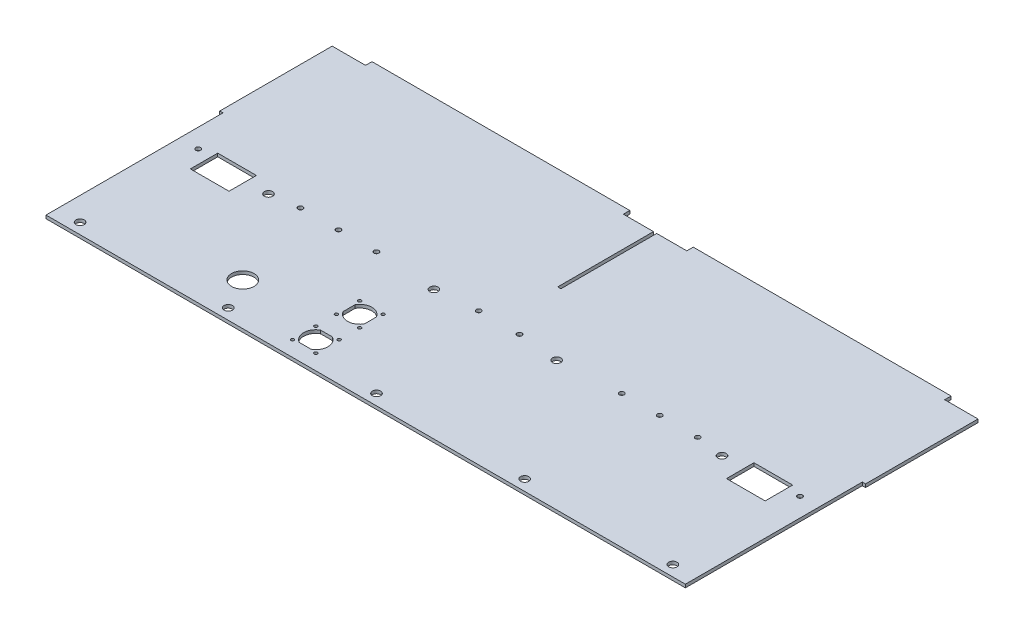
from build123d import *

# Parameters (mm, degrees)
SKETCH1_W            = 629.90984
SKETCH1_H            = 147.69846
BOSS_EXTRUDE1_DEPTH  = 3.175
SKETCH3_W            = 254
SKETCH3_H            = 3.175
BOSS_EXTRUDE2_DEPTH  = 6.35
SKETCH4_W            = 3.175
SKETCH4_H            = 188.732840052
CUT_EXTRUDE1_DEPTH   = 3.175
SKETCH6_W            = 3.175
SKETCH6_H            = 110.773845
BOSS_EXTRUDE4_DEPTH  = 3.175
SKETCH8_W            = 629.90984
SKETCH8_H            = 18.04416
BOSS_EXTRUDE5_DEPTH  = 3.175
SKETCH10_W           = 38.1
SKETCH10_H           = 36.08832
CUT_EXTRUDE3_DEPTH   = 652.56536379
BOSS_EXTRUDE6_DEPTH  = 3.175
SKETCH13_R           = 1.55
SKETCH13_R_2         = 11.049
CUT_EXTRUDE4_DEPTH   = 652.56536379
SKETCH20_W           = 20.59499956
SKETCH20_H           = 2.942142794
CUT_EXTRUDE7_DEPTH   = 1.27
SKETCH21_R           = 4.064
CUT_EXTRUDE8_DEPTH   = 652.56536379
SKETCH23_R           = 4.064
CUT_EXTRUDE10_DEPTH  = 652.56536379
M4_CLEARANCE_HOLE1_D = 4.8


with BuildPart() as part:
    # Sketch1 → Boss-Extrude1 (new body)
    with BuildSketch(Plane(origin=(0, 0, 0), x_dir=(1, 0, 0), z_dir=(0, 1, 0))):
        with Locations((314.95492, 73.84923)):
            Rectangle(SKETCH1_W, SKETCH1_H)
    extrude(amount=BOSS_EXTRUDE1_DEPTH)

    # Sketch3 → Boss-Extrude2 (add)
    with BuildSketch(Plane(origin=(0, 0, -147.69846), x_dir=(-1, 0, 0), z_dir=(0, 0, -1))):
        with Locations((-473.22613, 1.5875)):
            Rectangle(SKETCH3_W, SKETCH3_H)
        with Locations((-156.68371, 1.5875)):
            Rectangle(SKETCH3_W, SKETCH3_H)
    extrude(amount=BOSS_EXTRUDE2_DEPTH)

    # Sketch4 → Cut-Extrude1 (cut)
    with BuildSketch(Plane(origin=(0, 3.175, 0), x_dir=(1, 0, 0), z_dir=(0, 1, 0))):
        with Locations((314.95492, 147.69846)):
            Rectangle(SKETCH4_W, SKETCH4_H)
    extrude(amount=-CUT_EXTRUDE1_DEPTH, mode=Mode.SUBTRACT)

    # Sketch6 → Boss-Extrude4 (add)
    with BuildSketch(Plane(origin=(0, 3.175, 0), x_dir=(1, 0, 0), z_dir=(0, 1, 0))):
        with Locations((631.49734, 92.3115375)):
            Rectangle(SKETCH6_W, SKETCH6_H)
        with Locations((-1.5875, 92.3115375)):
            Rectangle(SKETCH6_W, SKETCH6_H)
    extrude(amount=-BOSS_EXTRUDE4_DEPTH)

    # Sketch8 → Boss-Extrude5 (add, through all)
    with BuildSketch(Plane(origin=(0, 3.175, 0), x_dir=(1, 0, 0), z_dir=(0, 1, 0))):
        with Locations((314.95492, -9.02208)):
            Rectangle(SKETCH8_W, SKETCH8_H)
    extrude(amount=-BOSS_EXTRUDE5_DEPTH)

    # Sketch10 → Cut-Extrude3 (cut, through all)
    with BuildSketch(Plane(origin=(0, 3.175, 0), x_dir=(1, 0, 0), z_dir=(0, 1, 0))):
        with Locations((579.10984, -18.04416)):
            Rectangle(SKETCH10_W, SKETCH10_H)
        with Locations((50.8, -18.04416)):
            Rectangle(SKETCH10_W, SKETCH10_H)
    extrude(amount=-CUT_EXTRUDE3_DEPTH, mode=Mode.SUBTRACT)

    # Sketch11 → Boss-Extrude6 (add, through all)
    with BuildSketch(Plane(origin=(0, 3.175, 0), x_dir=(1, 0, 0), z_dir=(0, 1, 0))):
        Polygon((0, -18.04416), (0, -137.42416), (629.90984, -137.42416), (629.90984, -18.04416), (598.15984, -18.04416), (598.15984, -27.06624), (560.05984, -27.06624), (560.05984, -18.04416), (386.39242, -18.04416), (348.29242, -18.04416), (281.61742, -18.04416), (243.51742, -18.04416), (69.85, -18.04416), (69.85, -26.95194), (31.75, -26.95194), (31.75, -18.04416), align=None)
    extrude(amount=-BOSS_EXTRUDE6_DEPTH)

    # Sketch13 → Cut-Extrude4 (cut, through all)
    with BuildSketch(Plane.XZ):
        with Locations(Location((227.731580951, 122.331796051, 0), (0, 0, 270))):
            Circle(SKETCH13_R)
        with Locations(Location((250.731580951, 122.331796051, 0), (0, 0, 270))):
            Circle(SKETCH13_R)
        with Locations(Location((227.731580951, 99.331796051, 0), (0, 0, 270))):
            Circle(SKETCH13_R)
        with Locations(Location((250.731580951, 99.331796051, 0), (0, 0, 270))):
            Circle(SKETCH13_R)
        with Locations(Location((152.328523542, 95.877856055, 0), (0, 0, 270))):
            Circle(SKETCH13_R_2)
        with Locations(Location((227.731580951, 79.083184621, 0), (0, 0, 270))):
            Circle(SKETCH13_R)
        with Locations(Location((227.731580951, 56.083184621, 0), (0, 0, 270))):
            Circle(SKETCH13_R)
        with Locations(Location((250.731580951, 56.083184621, 0), (0, 0, 270))):
            Circle(SKETCH13_R)
        with Locations(Location((250.731580951, 79.083184621, 0), (0, 0, 270))):
            Circle(SKETCH13_R)
        with BuildLine():
            Line((245.043121195, 100.323796051), (233.420040708, 100.323796051))
            ThreePointArc((233.420040708, 100.323796051), (227.223580951, 110.831796051), (233.420040708, 121.339796051))
            Line((233.420040708, 121.339796051), (245.043121195, 121.339796051))
            ThreePointArc((245.043121195, 121.339796051), (251.239580951, 110.831796051), (245.043121195, 100.323796051))
        make_face()
        with BuildLine():
            Line((249.739580951, 73.394724865), (249.739580951, 61.771644378))
            ThreePointArc((249.739580951, 61.771644378), (239.231580951, 55.575184621), (228.723580951, 61.771644378))
            Line((228.723580951, 61.771644378), (228.723580951, 73.394724865))
            ThreePointArc((228.723580951, 73.394724865), (239.231580951, 79.591184621), (249.739580951, 73.394724865))
        make_face()
    extrude(amount=-CUT_EXTRUDE4_DEPTH, mode=Mode.SUBTRACT)

    # Sketch20 → Cut-Extrude7 (cut)
    with BuildSketch(Plane.XZ):
        Polygon((269.946527362, 71.481147903), (278.936408122, 71.481147903), (278.936408122, 69.356266996), (269.946527362, 69.356266996), (269.946527362, 61.837457633), (266.18712268, 61.837457633), (266.18712268, 69.356266996), (258.341408562, 69.356266996), (258.341408562, 71.481147903), (266.18712268, 71.481147903), (266.18712268, 78.999957266), (269.946527362, 78.999957266), align=None)
        with Locations((268.638908342, 111.690432757)):
            Rectangle(SKETCH20_W, SKETCH20_H)
    extrude(amount=-CUT_EXTRUDE7_DEPTH, mode=Mode.SUBTRACT)

    # Sketch21 → Cut-Extrude8 (cut, through all)
    with BuildSketch(Plane(origin=(0, 3.175, 0), x_dir=(1, 0, 0), z_dir=(0, 1, 0))):
        with Locations(Location((168.943513391, -126.78664, 0), (0, 0, 270))):
            Circle(SKETCH21_R)
        with Locations(Location((314.95492, -126.78664, 0), (0, 0, 270))):
            Circle(SKETCH21_R)
        with Locations(Location((460.966326609, -126.78664, 0), (0, 0, 270))):
            Circle(SKETCH21_R)
        with Locations(Location((606.977733219, -126.78664, 0), (0, 0, 270))):
            Circle(SKETCH21_R)
        with Locations(Location((22.932106781, -126.78664, 0), (0, 0, 90))):
            Circle(SKETCH21_R)
    extrude(amount=-CUT_EXTRUDE8_DEPTH, mode=Mode.SUBTRACT)

    # Sketch23 → Cut-Extrude10 (cut, through all)
    with BuildSketch(Plane(origin=(0, 3.175, 0), x_dir=(1, 0, 0), z_dir=(0, 1, 0))):
        with Locations(Location((538.347516778, -9.779, 0), (0, 0, 270))):
            Circle(SKETCH23_R)
        with Locations(Location((375.40565, -9.779, 0), (0, 0, 270))):
            Circle(SKETCH23_R)
        with Locations(Location((254.50419, -9.779, 0), (0, 0, 270))):
            Circle(SKETCH23_R)
        with Locations(Location((91.562323222, -9.779, 0), (0, 0, 270))):
            Circle(SKETCH23_R)
    extrude(amount=-CUT_EXTRUDE10_DEPTH, mode=Mode.SUBTRACT)

    # M4 Clearance Hole1 (through all)
    with Locations(Plane(origin=(0, 3.175, 0), x_dir=(1, 0, 0), z_dir=(0, 1, 0))):
        with Locations((611.402306504, -5.996840051), (510.650895752, -5.996840051), (473.22613, -5.996840051), (435.801364248, -5.996840051), (335.049803495, -5.996840051), (294.860036505, -5.996840051), (194.108475752, -5.996840051), (156.68371, -5.996840051), (119.258944248, -5.996840051), (18.507533496, -5.996840051)):
            Hole(M4_CLEARANCE_HOLE1_D / 2)


solid = part.part
